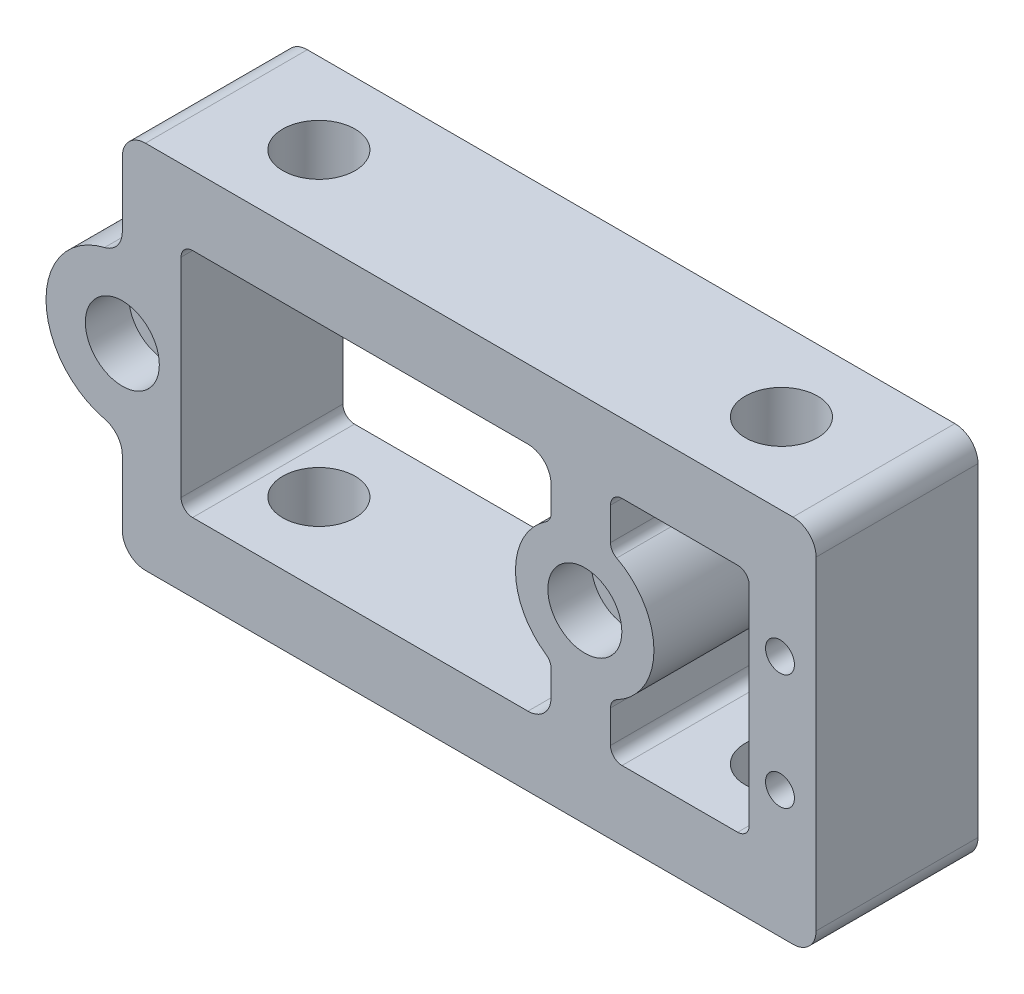
from build123d import *

# Parameters (mm, degrees)
SKETCH1_W           = 93.6625
SKETCH1_H           = 40.64
SKETCH1_R           = 2.4892
SKETCH1_R_2         = 1.5875
BOSS_EXTRUDE1_DEPTH = 17.78
SKETCH6_R           = 3.96875
CUT_EXTRUDE4_DEPTH  = 104.635910312
CUT_EXTRUDE3_DEPTH  = 17.78
FILLET1_R           = 2.54
SKETCH3_R           = 4.064
CUT_EXTRUDE5_DEPTH  = 4.7752
SKETCH7_W           = 9.113549332
SKETCH7_H           = 21.245092044
CUT_EXTRUDE6_DEPTH  = 98.141100599
SKETCH8_W           = 17.78
SKETCH8_H           = 25.4
CUT_EXTRUDE7_DEPTH  = 17.78
FILLET2_R           = 1.27


with BuildPart() as part:
    # Sketch1 → Boss-Extrude1 (new body)
    with BuildSketch(Plane.XY):
        with Locations((-46.83125, 0)):
            Rectangle(SKETCH1_W, SKETCH1_H)
        with Locations((-84.93125, 0)):
            Circle(SKETCH1_R, mode=Mode.SUBTRACT)
        with Locations((-34.13125, 0)):
            Circle(SKETCH1_R, mode=Mode.SUBTRACT)
        with Locations((-12.7, 6.35)):
            Circle(SKETCH1_R_2, mode=Mode.SUBTRACT)
        with Locations((-12.7, -6.35)):
            Circle(SKETCH1_R_2, mode=Mode.SUBTRACT)
    extrude(amount=-BOSS_EXTRUDE1_DEPTH)

    # Sketch6 → Cut-Extrude4 (cut, through all)
    with BuildSketch(Plane(origin=(0, 20.32, 0), x_dir=(1, 0, 0), z_dir=(0, 1, 0))):
        with Locations(Location((-72.23125, 8.89, 0), (0, 0, 270))):
            Circle(SKETCH6_R)
        with Locations(Location((-21.43125, 8.89, 0), (0, 0, 270))):
            Circle(SKETCH6_R)
    extrude(amount=-CUT_EXTRUDE4_DEPTH, mode=Mode.SUBTRACT)

    # Sketch5 → Cut-Extrude3 (cut)
    with BuildSketch(Plane.XY):
        with BuildLine():
            Line((-93.6625, -20.32), (-93.6625, 20.32))
            Line((-93.6625, 20.32), (-84.93125, 20.32))
            Line((-84.93125, 20.32), (-84.93125, 10.622546022))
            ThreePointArc((-84.93125, 10.622546022), (-85.477262526, 9.049137635), (-86.880552326, 8.152186482))
            ThreePointArc((-86.880552326, 8.152186482), (-93.31325, 0), (-86.880552326, -8.152186482))
            ThreePointArc((-86.880552326, -8.152186482), (-85.477262526, -9.049137635), (-84.93125, -10.622546022))
            Line((-84.93125, -10.622546022), (-84.93125, -20.32))
            Line((-84.93125, -20.32), (-93.6625, -20.32))
        make_face()
        with BuildLine():
            Line((0, -20.32), (0, 20.32))
            Line((0, 20.32), (-8.73125, 20.32))
            Line((-8.73125, 20.32), (-8.73125, 10.622546022))
            ThreePointArc((-8.73125, 10.622546022), (-8.185237474, 9.049137635), (-6.781947674, 8.152186482))
            ThreePointArc((-6.781947674, 8.152186482), (-0.34925, 0), (-6.781947674, -8.152186482))
            ThreePointArc((-6.781947674, -8.152186482), (-8.185237474, -9.049137635), (-8.73125, -10.622546022))
            Line((-8.73125, -10.622546022), (-8.73125, -20.32))
            Line((-8.73125, -20.32), (0, -20.32))
        make_face()
    extrude(amount=-CUT_EXTRUDE3_DEPTH, mode=Mode.SUBTRACT)

    # Fillet1
    fillet1_edges = [part.edges().sort_by_distance(p)[0] for p in [
        (-84.93125, 20.32, -8.89),
        (-84.93125, -20.32, -8.89),
        (-8.73125, 20.32, -8.89),
        (-8.73125, -20.32, -8.89),
    ]]
    fillet(fillet1_edges, radius=FILLET1_R)

    # Sketch3 → Cut-Extrude5 (cut)
    with BuildSketch(Plane.XY):
        with Locations((-84.93125, 0)):
            Circle(SKETCH3_R)
        with Locations((-34.13125, 0)):
            Circle(SKETCH3_R)
    extrude(amount=-CUT_EXTRUDE5_DEPTH, mode=Mode.SUBTRACT)

    # Sketch7 → Cut-Extrude6 (cut, through all)
    with BuildSketch(Plane.XY):
        with BuildLine():
            Line((-37.842518981, 10.16), (-37.842518981, 6.655139559))
            ThreePointArc((-37.842518981, 6.655139559), (-41.75125, 0), (-37.842518981, -6.655139559))
            Line((-37.842518981, -6.655139559), (-37.842518981, -10.16))
            ThreePointArc((-37.842518981, -10.16), (-38.586467757, -11.956051224), (-40.382518981, -12.7))
            Line((-40.382518981, -12.7), (-60.702518981, -12.7))
            ThreePointArc((-60.702518981, -12.7), (-62.498570205, -11.956051224), (-63.242518981, -10.16))
            Line((-63.242518981, -10.16), (-63.242518981, 10.16))
            ThreePointArc((-63.242518981, 10.16), (-62.498570205, 11.956051224), (-60.702518981, 12.7))
            Line((-60.702518981, 12.7), (-40.382518981, 12.7))
            ThreePointArc((-40.382518981, 12.7), (-38.586467757, 11.956051224), (-37.842518981, 10.16))
        make_face()
        with Locations((-4.174475334, 0)):
            Rectangle(SKETCH7_W, SKETCH7_H)
    extrude(amount=-CUT_EXTRUDE6_DEPTH, mode=Mode.SUBTRACT)

    # Sketch8 → Cut-Extrude7 (cut)
    with BuildSketch(Plane.XY):
        with Locations((-69.592518981, 0)):
            Rectangle(SKETCH8_W, SKETCH8_H)
        with BuildLine():
            Line((-31.316413003, 12.7), (-16.076413003, 12.7))
            Line((-16.076413003, 12.7), (-16.076413003, -12.7))
            Line((-16.076413003, -12.7), (-31.316413003, -12.7))
            Line((-31.316413003, -12.7), (-31.316413003, -7.046567735))
            ThreePointArc((-31.316413003, -7.046567735), (-26.543271075, 0), (-31.316413003, 7.046567735))
            Line((-31.316413003, 7.046567735), (-31.316413003, 12.7))
        make_face()
    extrude(amount=-CUT_EXTRUDE7_DEPTH, mode=Mode.SUBTRACT)

    # Fillet2
    fillet2_edges = [part.edges().sort_by_distance(p)[0] for p in [
        (-37.842518981, 6.655139559, -8.89),
        (-37.842518981, -6.655139559, -8.89),
        (-78.482518981, 12.7, -8.89),
        (-78.482518981, -12.7, -8.89),
        (-16.076413003, -12.7, -8.89),
        (-31.316413003, 12.7, -8.89),
        (-31.316413003, -12.7, -8.89),
        (-16.076413003, 12.7, -8.89),
        (-31.316413003, 7.046567735, -8.89),
        (-31.316413003, -7.046567735, -8.89),
    ]]
    fillet(fillet2_edges, radius=FILLET2_R)


solid = part.part
